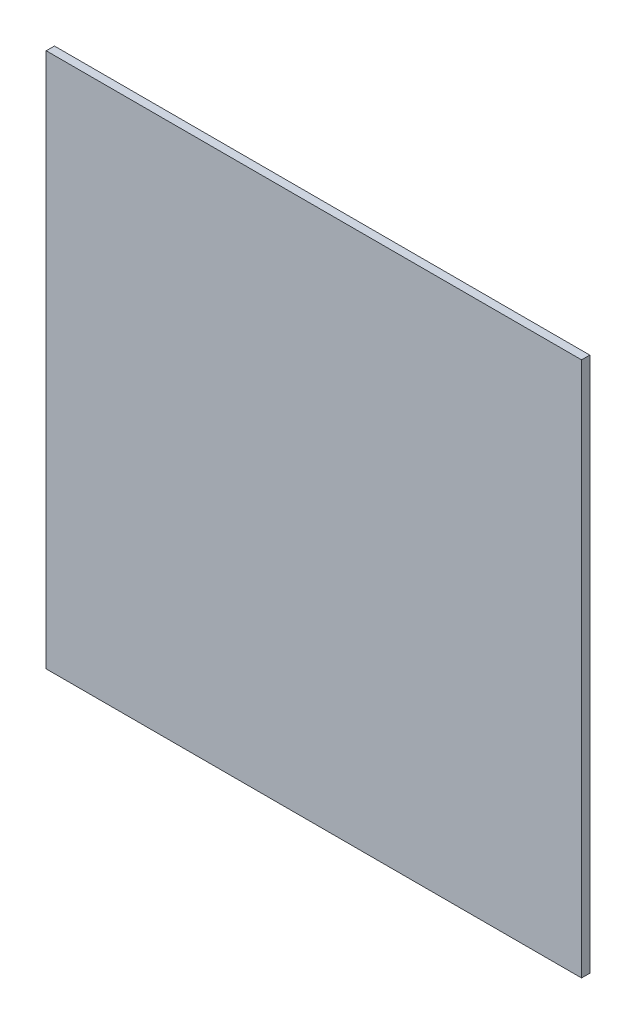
from build123d import *

# Parameters (mm, degrees)
ESBO_O1_W                = 32.5
ESBO_O1_H                = 32.5
RESSALTO_EXTRUS_O1_DEPTH = 0.5


with BuildPart() as part:
    # Esboço1 → Ressalto-extrusão1 (new body)
    with BuildSketch(Plane.XY):
        with Locations((3.13253012, -2.594126506)):
            Rectangle(ESBO_O1_W, ESBO_O1_H)
    extrude(amount=RESSALTO_EXTRUS_O1_DEPTH)


solid = part.part
